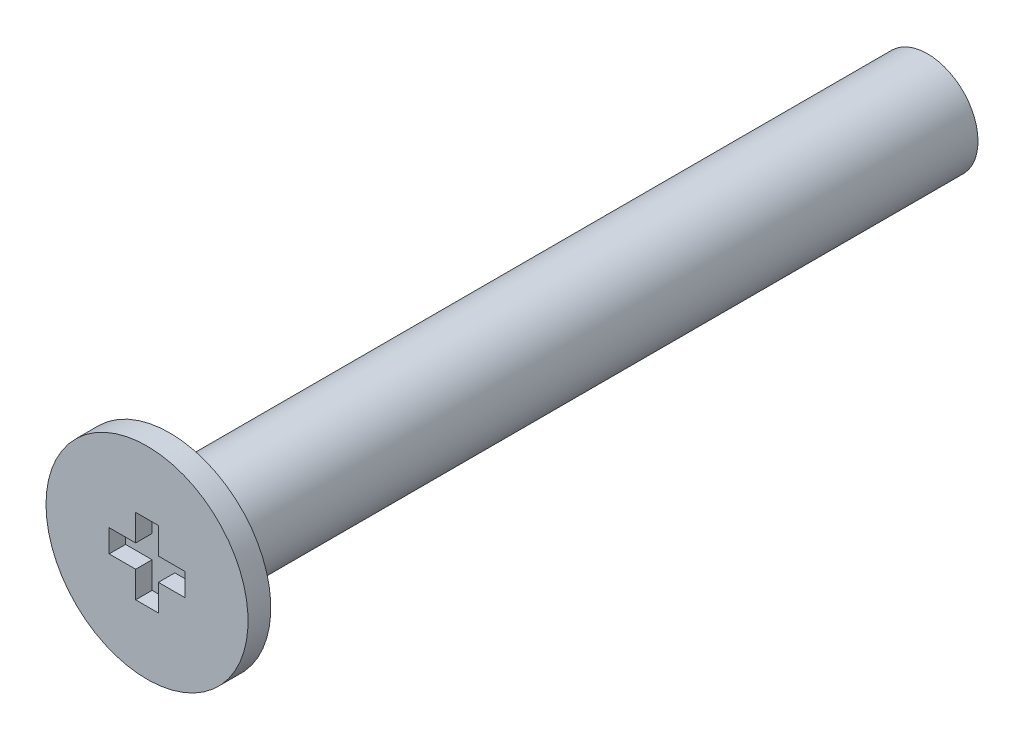
from build123d import *

# Parameters (mm, degrees)
SKETCH_1_R        = 2
EXTRUDE_198_DEPTH = 30
SKETCH_6_W        = 4
SKETCH_6_H        = 0.9
PH2_START         = 0.91
PH2_DEPTH         = 0.66


with BuildPart() as part:
    # 草图1 → Extrude 198 (new body)
    with BuildSketch(Plane.XY):
        Circle(SKETCH_1_R)
    extrude(amount=-EXTRUDE_198_DEPTH)

    # 草图6 → Revolve 324 (revolve)
    with BuildSketch(Plane(origin=(0, 0, 0), x_dir=(1, 0, 0), z_dir=(0, 1, 0)), mode=Mode.PRIVATE) as revolve_324_sk:
        with Locations((2, -0.45)):
            Rectangle(SKETCH_6_W, SKETCH_6_H)
    revolve(revolve_324_sk.sketch.rotate(Axis((0, 0, -2), (0, 0, 1)), 180), axis=Axis((0, 0, -2), (0, 0, 1)))

    # 草图7 → 十字槽_PH2_简化 (cut)
    with BuildSketch(Plane.XY.offset(PH2_START)):
        Polygon((-0.45, -1.5), (0.45, -1.5), (0.45, -0.45), (1.5, -0.45), (1.5, 0.45), (0.45, 0.45), (0.45, 1.5), (-0.45, 1.5), (-0.45, 0.45), (-1.5, 0.45), (-1.5, -0.45), (-0.45, -0.45), align=None)
    extrude(amount=-PH2_DEPTH, mode=Mode.SUBTRACT)


solid = part.part
